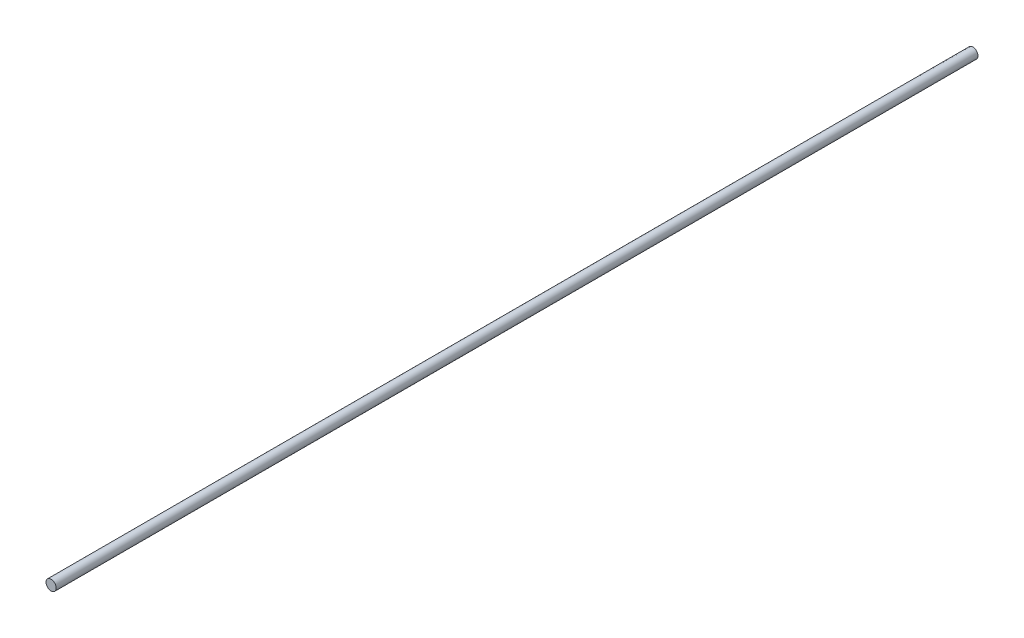
from build123d import *

# Parameters (mm, degrees)
ESQUISSE1_R        = 4
BOSS_EXTRU_1_DEPTH = 722


with BuildPart() as part:
    # Esquisse1 → Boss.-Extru.1 (new body)
    with BuildSketch(Plane.XY):
        Circle(ESQUISSE1_R)
    extrude(amount=BOSS_EXTRU_1_DEPTH)


solid = part.part
